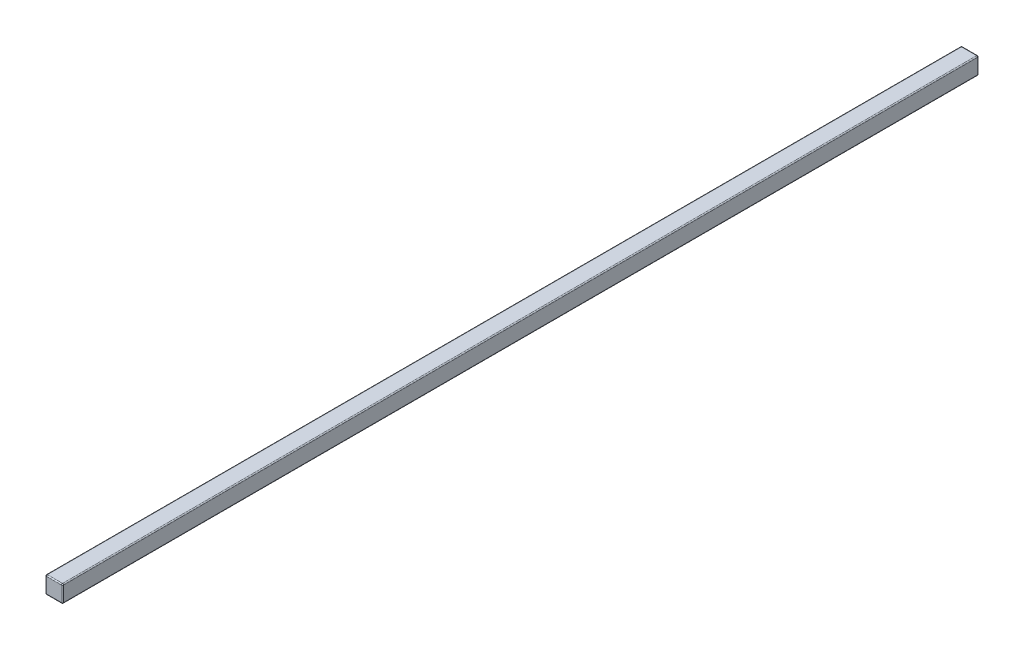
from build123d import *

# Parameters (mm, degrees)
SKETCH1_W           = 25
SKETCH1_H           = 25
BOSS_EXTRUDE1_DEPTH = 1336.6
FILLET1_R           = 1.5


with BuildPart() as part:
    # Sketch1 → Boss-Extrude1 (new body)
    with BuildSketch(Plane.XY):
        Rectangle(SKETCH1_W, SKETCH1_H)
    extrude(amount=BOSS_EXTRUDE1_DEPTH)

    # Fillet1
    fillet1_edges = [part.edges().sort_by_distance(p)[0] for p in [
        (-12.5, 0, 1336.6),
        (0, -12.5, 1336.6),
        (12.5, 0, 1336.6),
        (0, -12.5, 0),
        (-12.5, 0, 0),
        (0, 12.5, 0),
        (12.5, 0, 0),
        (0, 12.5, 1336.6),
        (12.5, -12.5, 668.3),
        (-12.5, -12.5, 668.3),
        (-12.5, 12.5, 668.3),
        (12.5, 12.5, 668.3),
    ]]
    fillet(fillet1_edges, radius=FILLET1_R)


solid = part.part
